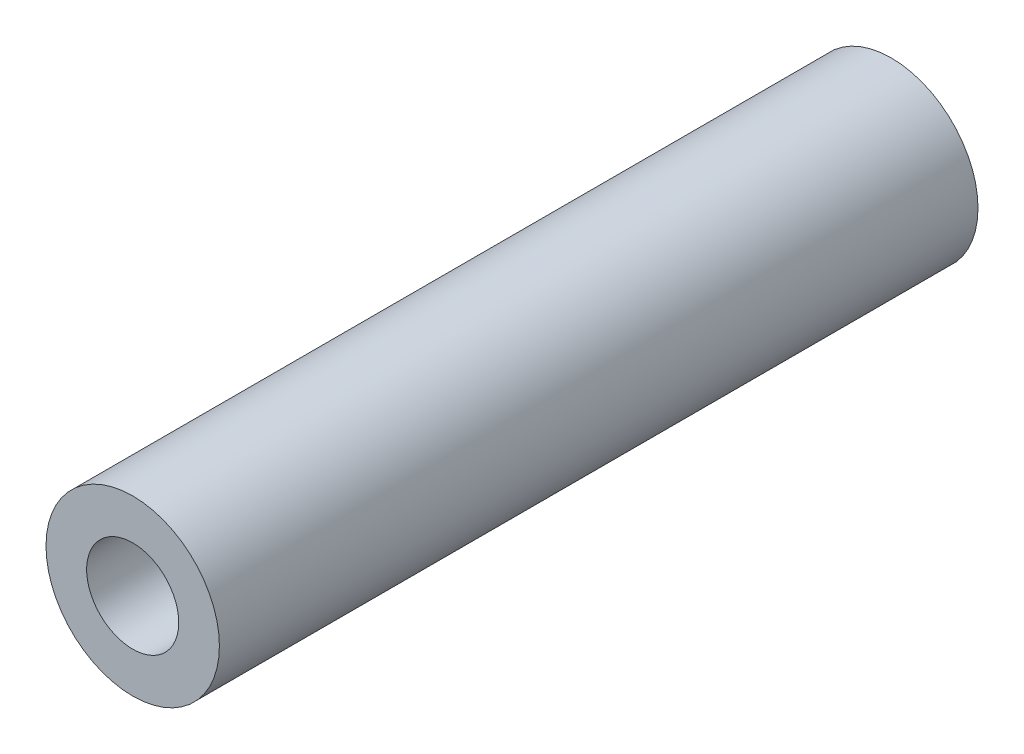
from build123d import *

# Parameters (mm, degrees)
SKETCH1_R                                    = 8
F_16_MM_MOVING_ROD_REPRESENTATION_DEPTH      = 70
M10_START                                    = 58
SKETCH2_R                                    = 4.25
M10_X_1_5_FEMALE_THREAD_CORE_12_MM_DEP_DEPTH = 12


with BuildPart() as part:
    # Sketch1 → 16 mm moving rod representation (new body)
    with BuildSketch(Plane.XY):
        Circle(SKETCH1_R)
    extrude(amount=F_16_MM_MOVING_ROD_REPRESENTATION_DEPTH)

    # Sketch2 → M10 x 1.5 female thread core - 12 mm depth (cut)
    with BuildSketch(Plane.XY.offset(M10_START)):
        Circle(SKETCH2_R)
    extrude(amount=M10_X_1_5_FEMALE_THREAD_CORE_12_MM_DEP_DEPTH, mode=Mode.SUBTRACT)


solid = part.part
